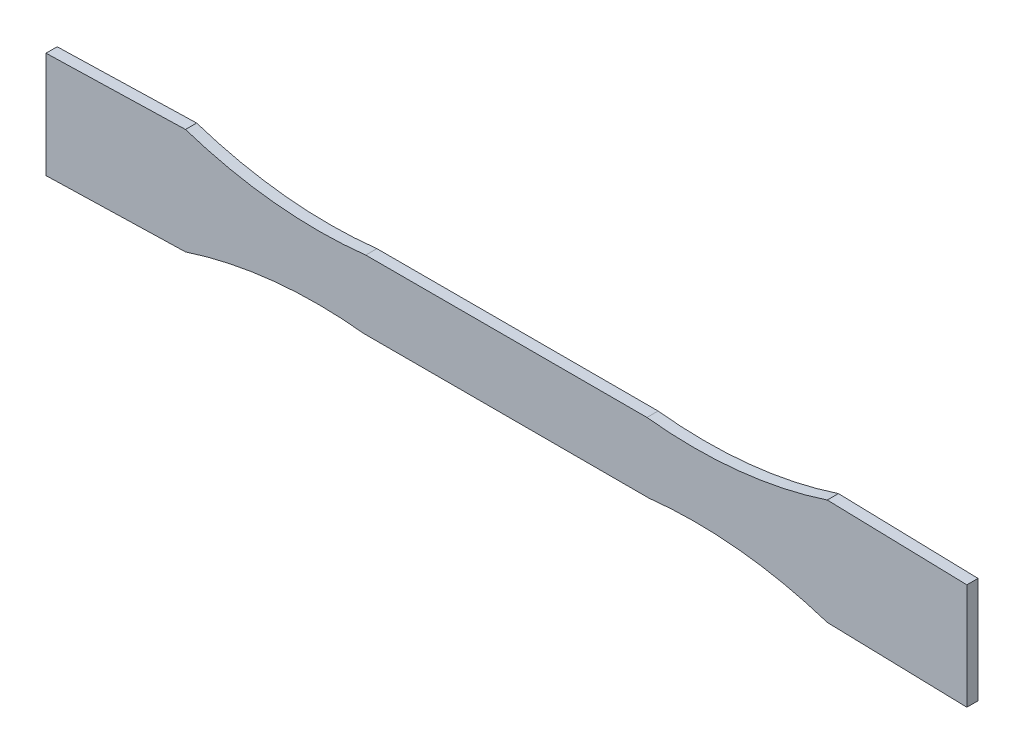
from build123d import *

# Parameters (mm, degrees)
BOSS_EXTRUDE3_DEPTH = 2


with BuildPart() as part:
    # Sketch2 → Boss-Extrude3 (new body)
    with BuildSketch(Plane.XY):
        with BuildLine():
            Line((-46.617380763, -10.460553871), (-21.626035611, -9.802779228))
            ThreePointArc((-21.626035611, -9.802779228), (-5.813327465, -6.438323514), (10.353247207, -6.494577557))
            Line((10.353247207, -6.494577557), (61.390562189, -6.494577557))
            ThreePointArc((61.390562189, -6.494577557), (77.567971425, -6.436016399), (93.391274085, -9.802779228))
            Line((93.391274085, -9.802779228), (118.382619237, -10.460553871))
            Line((118.382619237, -10.460553871), (118.382619237, 8.539446129))
            Line((118.382619237, 8.539446129), (93.373964389, 9.197220772))
            ThreePointArc((93.373964389, 9.197220772), (77.401482855, 5.780517491), (61.067824801, 5.855632475))
            Line((61.067824801, 5.855632475), (10.675984594, 5.855632475))
            ThreePointArc((10.675984594, 5.855632475), (-5.655590446, 5.780965556), (-21.626035611, 9.197220772))
            Line((-21.626035611, 9.197220772), (-46.617380763, 8.539446129))
            Line((-46.617380763, 8.539446129), (-46.617380763, -10.460553871))
        make_face()
    extrude(amount=BOSS_EXTRUDE3_DEPTH)


solid = part.part
